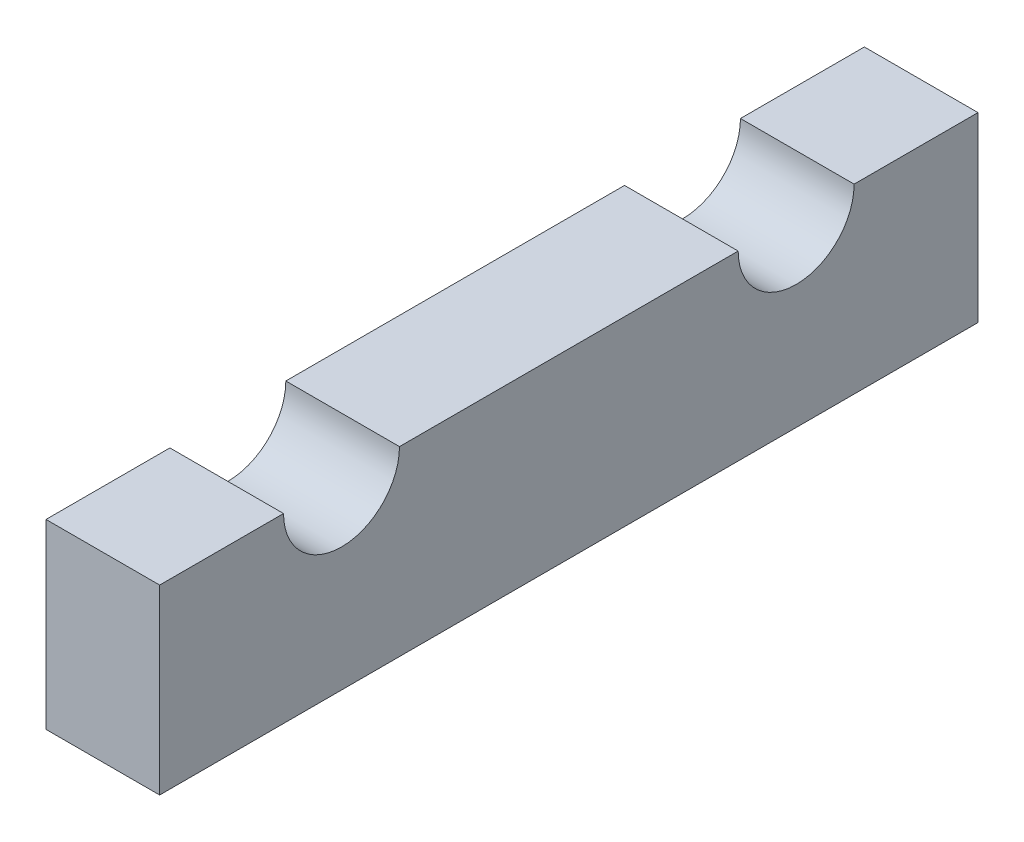
from build123d import *

# Parameters (mm, degrees)
EXTRUDE_1_DEPTH = 5


with BuildPart() as part:
    # 草图2 → 凸台-拉伸1 (new body)
    with BuildSketch(Plane(origin=(0, 0, 0), x_dir=(0, 0, -1), z_dir=(1, 0, 0))):
        with BuildLine():
            Line((-7.45, 8), (7.45, 8))
            ThreePointArc((7.45, 8), (10, 5.45), (12.55, 8))
            Line((12.55, 8), (18, 8))
            Line((18, 8), (18, 0))
            Line((18, 0), (-18, 0))
            Line((-18, 0), (-18, 8))
            Line((-18, 8), (-12.55, 8))
            ThreePointArc((-12.55, 8), (-10, 5.45), (-7.45, 8))
        make_face()
    extrude(amount=EXTRUDE_1_DEPTH)


solid = part.part
